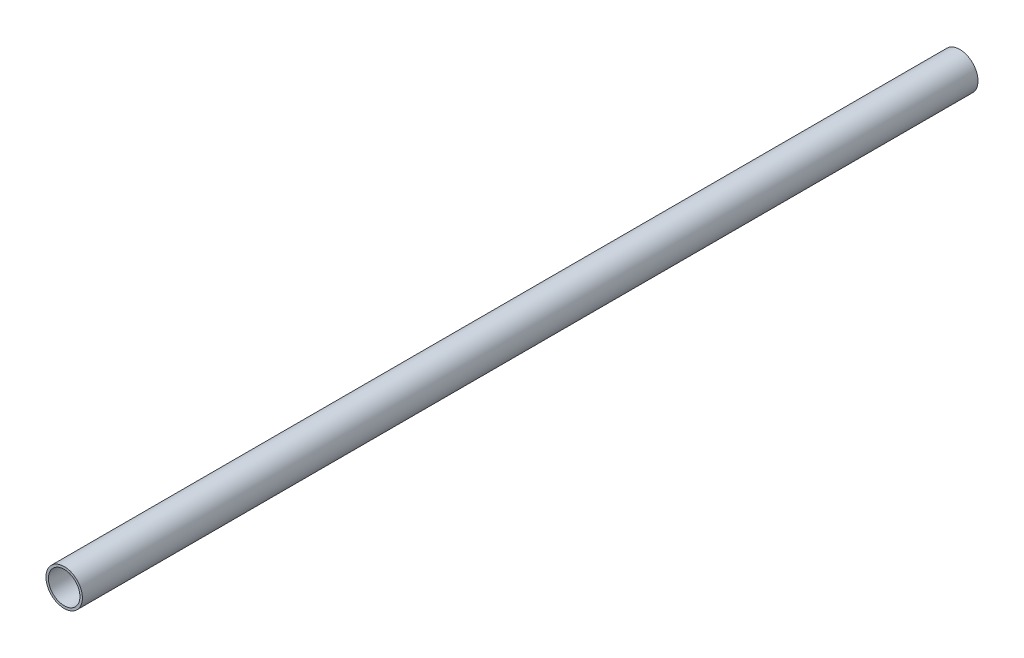
from build123d import *

# Parameters (mm, degrees)
CROQUIS1_R                 = 6.35
SALIENTE_EXTRUIR1_DEPTH    = 312.3
CORTAR_EXTRUIR1_DEPTH      = 102
CORTAR_EXTRUIR1_DEPTH_BACK = 352.3
CROQUIS2_R                 = 5.5


with BuildPart() as part:
    # Croquis1 → Saliente-Extruir1 (new body)
    with BuildSketch(Plane.XY):
        Circle(CROQUIS1_R)
    extrude(amount=SALIENTE_EXTRUIR1_DEPTH)

    # Croquis2 → Cortar-Extruir1 (cut, two sides: drawn at the far end of the back side and taken through both)
    with BuildSketch(Plane.XY.offset(312.3).offset(-CORTAR_EXTRUIR1_DEPTH_BACK)):
        Circle(CROQUIS2_R)
    extrude(amount=CORTAR_EXTRUIR1_DEPTH + CORTAR_EXTRUIR1_DEPTH_BACK, mode=Mode.SUBTRACT)


solid = part.part
